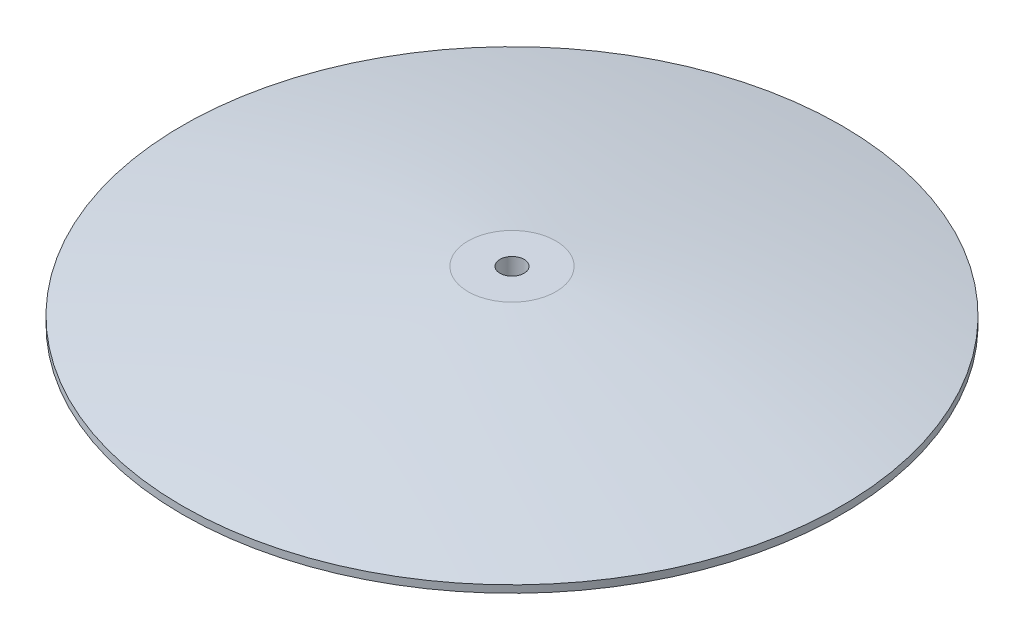
from build123d import *

# Parameters (mm, degrees)
SKETCH_3_R          = 1.65
CUT_EXTRUDE_1_DEPTH = 10


with BuildPart() as part:
    # 草图2 → 旋转1 (revolve)
    with BuildSketch(Plane.XY, mode=Mode.PRIVATE) as revolve_1_sk:
        with BuildLine():
            add(Edge.make_bspline(
                [(0, 3.824337562), (22.663053636, 4.045850944), (45, 0)],
                knots=[0, 0, 0, 1, 1, 1], degree=2))
            Line((45, 0), (45, 1))
            add(Edge.make_bspline(
                [(6, 6.848433077), (25.664360661, 5.106569795), (45, 1)],
                knots=[0.132220311, 0.132220311, 0.132220311, 1, 1, 1], degree=2))
            Line((6, 6.848433077), (0, 6.848433077))
            Line((0, 6.848433077), (0, 3.824337562))
        make_face()
    revolve(revolve_1_sk.sketch.rotate(Axis((0, 7.324337562, 0), (0, -1, 0)), 90), axis=Axis((0, 7.324337562, 0), (0, -1, 0)))

    # 草图3 → 切除-拉伸1 (cut)
    with BuildSketch(Plane(origin=(0, 6.848433077, 0), x_dir=(1, 0, 0), z_dir=(0, 1, 0))):
        with Locations(Location((0, 0, 0), (0, 0, 270))):
            Circle(SKETCH_3_R)
    extrude(amount=-CUT_EXTRUDE_1_DEPTH, mode=Mode.SUBTRACT)


solid = part.part
